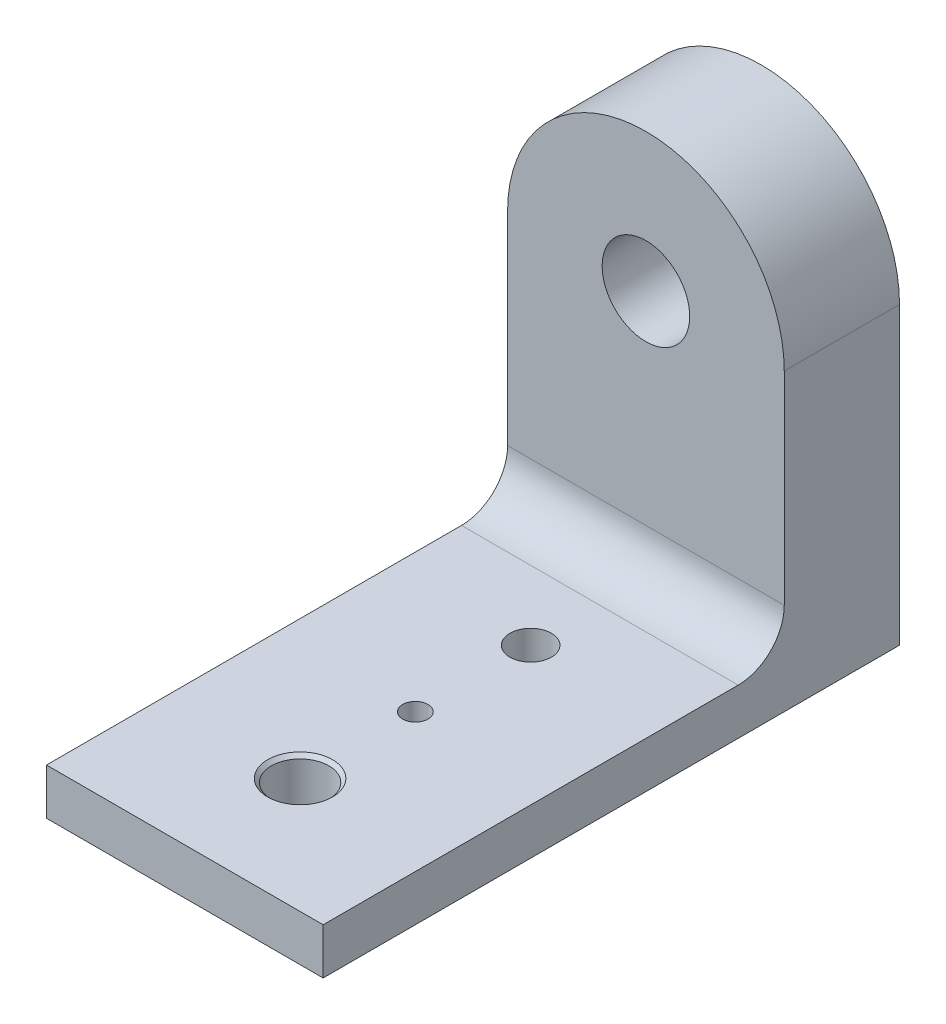
from build123d import *

# Parameters (mm, degrees)
SKETCH1_W                        = 60
SKETCH1_H                        = 125
BOSS_EXTRUDE1_DEPTH              = 10
SKETCH2_R                        = 9.5
BOSS_EXTRUDE2_DEPTH              = 25
CUT_EXTRUDE1_REACH               = 164.114
SKETCH3_R                        = 2.75
M10X1_0_TAPPED_HOLE1_D           = 9
M14X1_5_TAPPED_HOLE1_D           = 12.5
M14X1_5_TAPPED_HOLE1_CSINK_D     = 14.05
M14X1_5_TAPPED_HOLE1_CSINK_ANGLE = 90
FILLET1_R                        = 10


with BuildPart() as part:
    # Sketch1 → Boss-Extrude1 (new body)
    with BuildSketch(Plane(origin=(0, 0, 0), x_dir=(1, 0, 0), z_dir=(0, 1, 0))):
        with Locations((30, 62.5)):
            Rectangle(SKETCH1_W, SKETCH1_H)
    extrude(amount=BOSS_EXTRUDE1_DEPTH)

    # Sketch2 → Boss-Extrude2 (add)
    with BuildSketch(Plane(origin=(0, 0, -125), x_dir=(-1, 0, 0), z_dir=(0, 0, -1))):
        with BuildLine():
            Line((-60, 10), (0, 10))
            Line((0, 10), (0, 64))
            ThreePointArc((0, 64), (-30, 94), (-60, 64))
            Line((-60, 64), (-60, 10))
        make_face()
        with Locations((-30, 64)):
            Circle(SKETCH2_R, mode=Mode.SUBTRACT)
    extrude(amount=-BOSS_EXTRUDE2_DEPTH)

    # Sketch3 → Cut-Extrude1 (cut, up to next)
    with BuildSketch(Plane(origin=(0, 10, 0), x_dir=(1, 0, 0), z_dir=(0, 1, 0)), mode=Mode.PRIVATE) as cut_extrude1_sk1:
        with Locations(Location((30, 50, 0), (0, 0, 270))):
            Circle(SKETCH3_R)
    cut_extrude1_tool1 = extrude(cut_extrude1_sk1.sketch, amount=-CUT_EXTRUDE1_REACH, mode=Mode.PRIVATE) & part.part
    add(cut_extrude1_tool1.solids().sort_by_distance((30, 10, -50))[0], mode=Mode.SUBTRACT)

    # M10x1.0 Tapped Hole1 (through all)
    with Locations(Plane(origin=(0, 10, 0), x_dir=(1, 0, 0), z_dir=(0, 1, 0))):
        with Locations((30, 75)):
            Hole(M10X1_0_TAPPED_HOLE1_D / 2)

    # M14x1.5 Tapped Hole1 (through all)
    with Locations(Plane(origin=(0, 10, 0), x_dir=(1, 0, 0), z_dir=(0, 1, 0))):
        with Locations((30, 25)):
            CounterSinkHole(M14X1_5_TAPPED_HOLE1_D / 2, M14X1_5_TAPPED_HOLE1_CSINK_D / 2, counter_sink_angle=M14X1_5_TAPPED_HOLE1_CSINK_ANGLE)

    # Fillet1
    fillet1_edges = [part.edges().sort_by_distance(p)[0] for p in [
        (30, 10, -100),
    ]]
    fillet(fillet1_edges, radius=FILLET1_R)


solid = part.part
